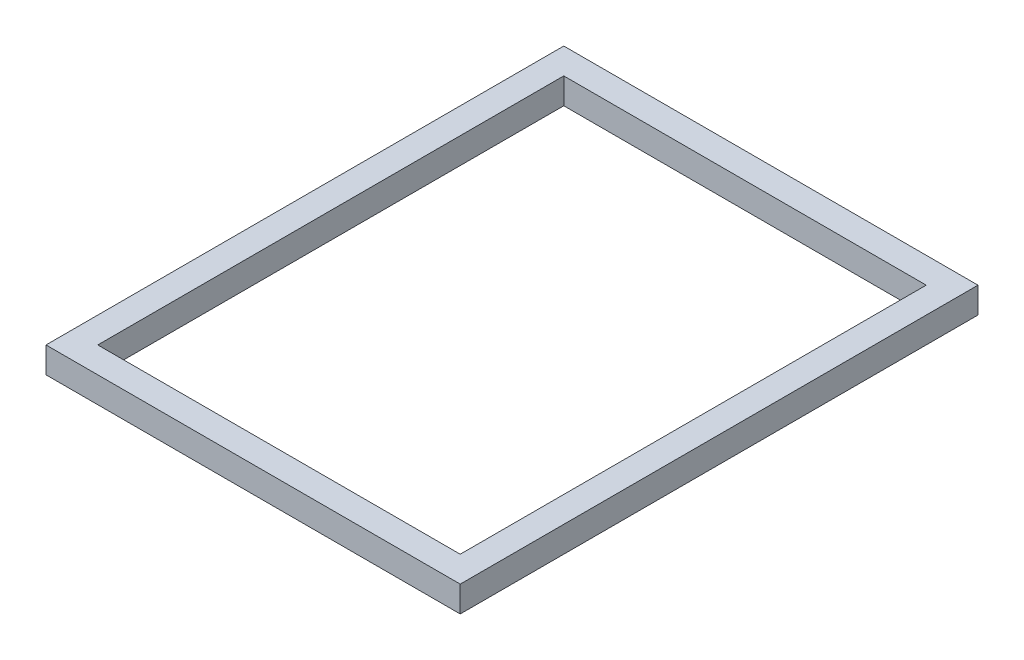
from build123d import *

# Parameters (mm, degrees)
SKETCH1_W           = 25.4
SKETCH1_H           = 31.75
SKETCH1_W_2         = 22.225
SKETCH1_H_2         = 28.575
BOSS_EXTRUDE1_DEPTH = 1.5875


with BuildPart() as part:
    # Sketch1 → Boss-Extrude1 (new body)
    with BuildSketch(Plane(origin=(0, 0, 0), x_dir=(1, 0, 0), z_dir=(0, 1, 0))):
        with Locations((12.7, 15.875)):
            Rectangle(SKETCH1_W, SKETCH1_H)
        with Locations((12.7, 15.875)):
            Rectangle(SKETCH1_W_2, SKETCH1_H_2, mode=Mode.SUBTRACT)
    extrude(amount=BOSS_EXTRUDE1_DEPTH)


solid = part.part
